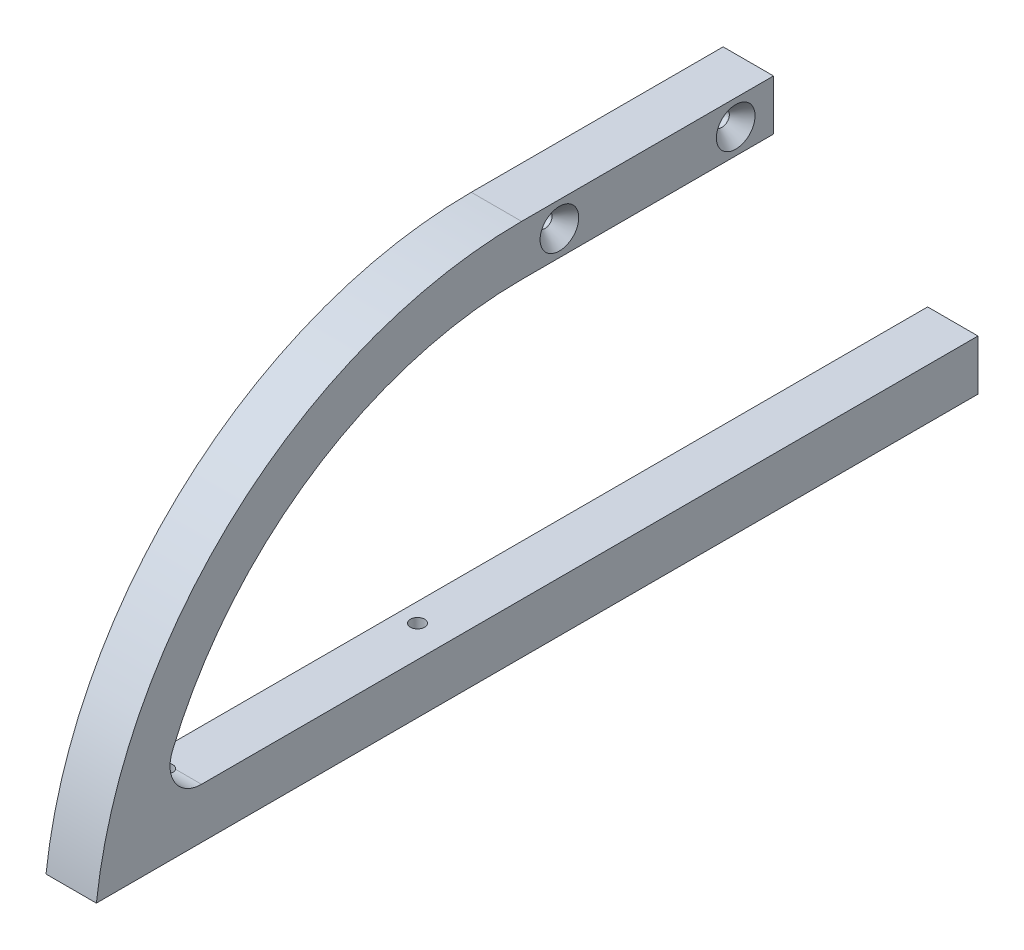
from build123d import *

# Parameters (mm, degrees)
BOSS_EXTRUDE1_DEPTH                               = 10.16
SKETCH2_R                                         = 1.4859
CUT_EXTRUDE2_DEPTH                                = 157.71111347
CUT_EXTRUDE3_REACH                                = 158.711
SKETCH3_R                                         = 1.4224
CSK_FOR_3_FLAT_HEAD_MACHINE_SCREW_100_D           = 2.794
CSK_FOR_3_FLAT_HEAD_MACHINE_SCREW_100_CSINK_D     = 7.7978
CSK_FOR_3_FLAT_HEAD_MACHINE_SCREW_100_CSINK_ANGLE = 82


with BuildPart() as part:
    # Sketch1 → Boss-Extrude1 (new body)
    with BuildSketch(Plane(origin=(0, 0, 0), x_dir=(0, 0, -1), z_dir=(1, 0, 0))):
        with BuildLine():
            Line((-136.560270522, -76.2), (41.239729478, -76.2))
            Line((41.239729478, -76.2), (41.239729478, -66.04))
            Line((41.239729478, -66.04), (-115.357986338, -66.04))
            ThreePointArc((-115.357986338, -66.04), (-120.636166121, -63.220342502), (-121.226894187, -57.265454545))
            ThreePointArc((-121.226894187, -57.265454545), (-93.164110025, -23.021842608), (-50.8, -10.16))
            Line((-50.8, -10.16), (0, -10.16))
            Line((0, -10.16), (0, 0))
            Line((0, 0), (-50.8, 0))
            ThreePointArc((-50.8, 0), (-108.161276136, -21.802013662), (-136.560270522, -76.2))
        make_face()
    extrude(amount=BOSS_EXTRUDE1_DEPTH)

    # Sketch2 → Cut-Extrude2 (cut, through all)
    with BuildSketch(Plane(origin=(10.16, 0, 0), x_dir=(0, 0, -1), z_dir=(1, 0, 0))):
        with Locations((-7.62, -5.08)):
            Circle(SKETCH2_R)
    extrude(amount=-CUT_EXTRUDE2_DEPTH, mode=Mode.SUBTRACT)

    # Sketch3 → Cut-Extrude3 (cut, up to next)
    with BuildSketch(Plane.XZ.offset(76.2), mode=Mode.PRIVATE) as cut_extrude3_sk1:
        with Locations(Location((3.81, 116.240270522, 0), (0, 0, 270))):
            Circle(SKETCH3_R)
    cut_extrude3_tool1 = extrude(cut_extrude3_sk1.sketch, amount=-CUT_EXTRUDE3_REACH, mode=Mode.PRIVATE) & part.part
    # Sketch3 → Cut-Extrude3 (cut, up to next)
    with BuildSketch(Plane.XZ.offset(76.2), mode=Mode.PRIVATE) as cut_extrude3_sk2:
        with Locations(Location((3.81, 65.440270522, 0), (0, 0, 270))):
            Circle(SKETCH3_R)
    cut_extrude3_tool2 = extrude(cut_extrude3_sk2.sketch, amount=-CUT_EXTRUDE3_REACH, mode=Mode.PRIVATE) & part.part
    add(cut_extrude3_tool1.solids().sort_by_distance((3.81, -76.2, 116.240271))[0], mode=Mode.SUBTRACT)
    add(cut_extrude3_tool2.solids().sort_by_distance((3.81, -76.2, 65.440271))[0], mode=Mode.SUBTRACT)

    # CSK for #3 Flat Head Machine Screw (100)1 (through all)
    with Locations(Plane(origin=(10.16, 0, 0), x_dir=(0, 0, -1), z_dir=(1, 0, 0))):
        with Locations((-7.62, -5.08)):
            csk_for_3_flat_head_machine_screw_100 = CounterSinkHole(CSK_FOR_3_FLAT_HEAD_MACHINE_SCREW_100_D / 2, CSK_FOR_3_FLAT_HEAD_MACHINE_SCREW_100_CSINK_D / 2, counter_sink_angle=CSK_FOR_3_FLAT_HEAD_MACHINE_SCREW_100_CSINK_ANGLE)

    # Mirror1: CSK for #3 Flat Head Machine Screw (100)1 across plane
    add(csk_for_3_flat_head_machine_screw_100.mirror(Plane(origin=(0, 0, 25.4), x_dir=(1, 0, 0), z_dir=(0, 0, -1))), mode=Mode.SUBTRACT)


solid = part.part
